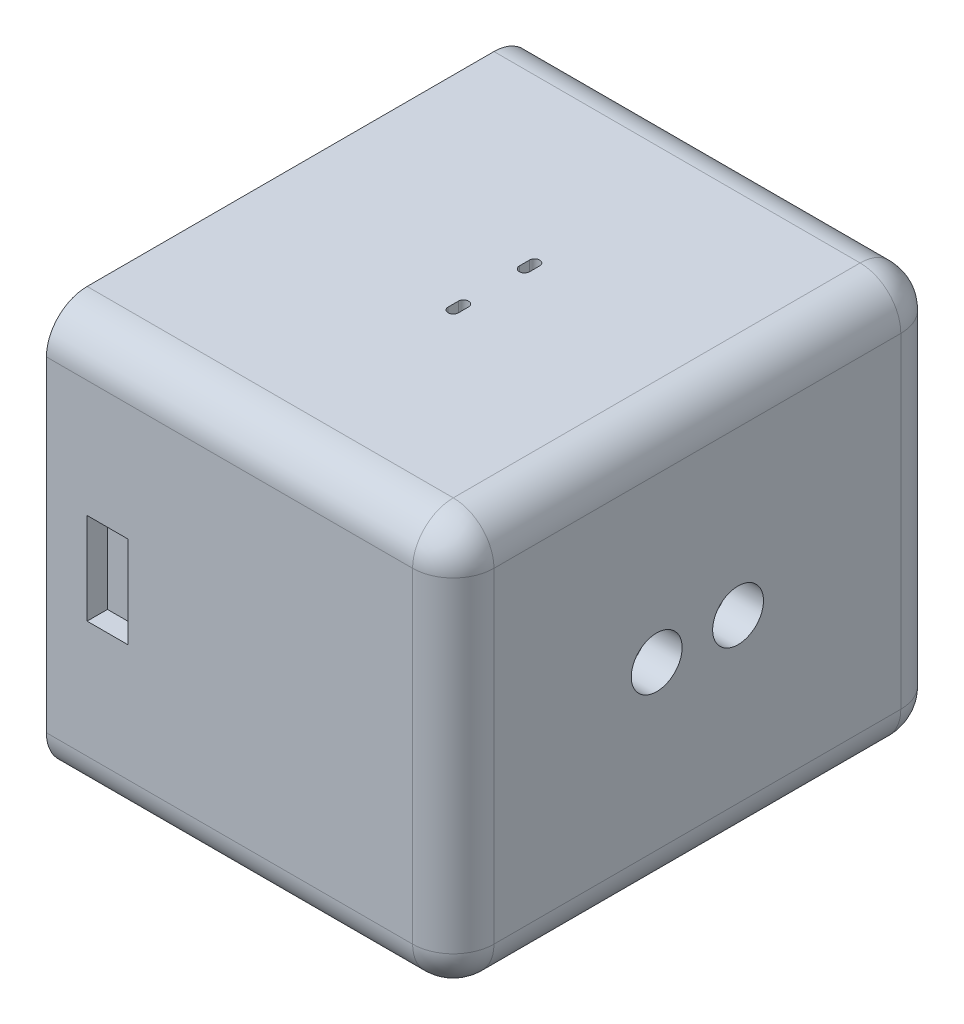
from build123d import *

# Parameters (mm, degrees)
SKETCH1_W           = 127
SKETCH1_H           = 152.4
BOSS_EXTRUDE1_DEPTH = 127
SHELL1_T            = -12.7
FILLET1_R           = 12.7
SKETCH3_W           = 23.988888889
SKETCH3_H           = 69.85
CUT_EXTRUDE1_DEPTH  = 9.525
SKETCH4_W           = 34.925
SKETCH4_H           = 79.375
CUT_EXTRUDE2_DEPTH  = 3.175
SKETCH5_W           = 12.7
SKETCH5_H           = 28.575
CUT_EXTRUDE3_DEPTH  = 6.35
CUT_EXTRUDE4_REACH  = 233.492
SKETCH6_W           = 6.35
SKETCH6_H           = 3.81
SKETCH7_R           = 7.9375
CUT_EXTRUDE5_DEPTH  = 11.1125
CUT_EXTRUDE6_REACH  = 231.749
SKETCH8_W           = 46.0375
SKETCH8_H           = 20.6375
CUT_EXTRUDE7_REACH  = 237.55
SKETCH9_R           = 2.38125
CUT_EXTRUDE8_REACH  = 237.55


with BuildPart() as part:
    # Sketch1 → Boss-Extrude1 (new body)
    with BuildSketch(Plane(origin=(0, 0, 0), x_dir=(1, 0, 0), z_dir=(0, 1, 0))):
        with Locations((63.5, 76.2)):
            Rectangle(SKETCH1_W, SKETCH1_H)
    extrude(amount=BOSS_EXTRUDE1_DEPTH)

    # Shell1
    shell1_openings = [part.faces().sort_by_distance(p)[0] for p in [
        (0, 63.5, -76.2),
    ]]
    offset(amount=SHELL1_T, openings=shell1_openings, kind=Kind.INTERSECTION)

    # Fillet1
    fillet1_edges = [part.edges().sort_by_distance(p)[0] for p in [
        (127, 127, -76.2),
        (63.5, 127, -152.4),
        (63.5, 0, -152.4),
        (127, 0, -76.2),
        (63.5, 0, 0),
        (63.5, 127, 0),
        (127, 63.5, -152.4),
        (127, 63.5, 0),
    ]]
    fillet(fillet1_edges, radius=FILLET1_R)

    # Sketch3 → Cut-Extrude1 (cut)
    with BuildSketch(Plane.XZ):
        with Locations((37.394444445, -76.2)):
            Rectangle(SKETCH3_W, SKETCH3_H)
    extrude(amount=-CUT_EXTRUDE1_DEPTH, mode=Mode.SUBTRACT)

    # Sketch4 → Cut-Extrude2 (cut)
    with BuildSketch(Plane(origin=(0, 12.7, 0), x_dir=(1, 0, 0), z_dir=(0, 1, 0))):
        with Locations((37.39388, 76.2)):
            Rectangle(SKETCH4_W, SKETCH4_H)
    extrude(amount=-CUT_EXTRUDE2_DEPTH, mode=Mode.SUBTRACT)

    # Sketch5 → Cut-Extrude3 (cut)
    with BuildSketch(Plane.XY):
        with Locations((19.05, 63.5)):
            Rectangle(SKETCH5_W, SKETCH5_H)
    extrude(amount=-CUT_EXTRUDE3_DEPTH, mode=Mode.SUBTRACT)

    # Sketch6 → Cut-Extrude4 (cut, up to next)
    with BuildSketch(Plane.XY.offset(-6.35), mode=Mode.PRIVATE) as cut_extrude4_sk1:
        with Locations((19.05, 75.8825)):
            Rectangle(SKETCH6_W, SKETCH6_H)
    cut_extrude4_tool1 = extrude(cut_extrude4_sk1.sketch, amount=-CUT_EXTRUDE4_REACH, mode=Mode.PRIVATE) & part.part
    add(cut_extrude4_tool1.solids().sort_by_distance((19.05, 75.8825, -6.35))[0], mode=Mode.SUBTRACT)

    # Sketch7 → Cut-Extrude5 (cut)
    with BuildSketch(Plane(origin=(127, 0, 0), x_dir=(0, 0, -1), z_dir=(1, 0, 0))):
        with Locations((63.5, 63.5)):
            Circle(SKETCH7_R)
        with Locations((88.9, 63.5)):
            Circle(SKETCH7_R)
    extrude(amount=-CUT_EXTRUDE5_DEPTH, mode=Mode.SUBTRACT)

    # Sketch8 → Cut-Extrude6 (cut, up to next)
    with BuildSketch(Plane(origin=(115.8875, 0, 0), x_dir=(0, 0, -1), z_dir=(1, 0, 0)), mode=Mode.PRIVATE) as cut_extrude6_sk1:
        with Locations((76.2, 63.5)):
            Rectangle(SKETCH8_W, SKETCH8_H)
    cut_extrude6_tool1 = extrude(cut_extrude6_sk1.sketch, amount=-CUT_EXTRUDE6_REACH, mode=Mode.PRIVATE) & part.part
    add(cut_extrude6_tool1.solids().sort_by_distance((115.8875, 63.5, -76.2))[0], mode=Mode.SUBTRACT)

    # Sketch9 → Cut-Extrude7 (cut, up to next)
    with BuildSketch(Plane(origin=(0, 0, -152.4), x_dir=(-1, 0, 0), z_dir=(0, 0, -1)), mode=Mode.PRIVATE) as cut_extrude7_sk1:
        with Locations((-38.1, 76.2)):
            Circle(SKETCH9_R)
    cut_extrude7_tool1 = extrude(cut_extrude7_sk1.sketch, amount=-CUT_EXTRUDE7_REACH, mode=Mode.PRIVATE) & part.part
    # Sketch9 → Cut-Extrude7 (cut, up to next)
    with BuildSketch(Plane(origin=(0, 0, -152.4), x_dir=(-1, 0, 0), z_dir=(0, 0, -1)), mode=Mode.PRIVATE) as cut_extrude7_sk2:
        with Locations((-38.1, 63.5)):
            Circle(SKETCH9_R)
    cut_extrude7_tool2 = extrude(cut_extrude7_sk2.sketch, amount=-CUT_EXTRUDE7_REACH, mode=Mode.PRIVATE) & part.part
    # Sketch9 → Cut-Extrude7 (cut, up to next)
    with BuildSketch(Plane(origin=(0, 0, -152.4), x_dir=(-1, 0, 0), z_dir=(0, 0, -1)), mode=Mode.PRIVATE) as cut_extrude7_sk3:
        with Locations((-38.1, 50.8)):
            Circle(SKETCH9_R)
    cut_extrude7_tool3 = extrude(cut_extrude7_sk3.sketch, amount=-CUT_EXTRUDE7_REACH, mode=Mode.PRIVATE) & part.part
    add(cut_extrude7_tool1.solids().sort_by_distance((38.1, 76.2, -152.4))[0], mode=Mode.SUBTRACT)
    add(cut_extrude7_tool2.solids().sort_by_distance((38.1, 63.5, -152.4))[0], mode=Mode.SUBTRACT)
    add(cut_extrude7_tool3.solids().sort_by_distance((38.1, 50.8, -152.4))[0], mode=Mode.SUBTRACT)

    # Sketch10 → Cut-Extrude8 (cut, up to next)
    with BuildSketch(Plane(origin=(0, 127, 0), x_dir=(1, 0, 0), z_dir=(0, 1, 0)), mode=Mode.PRIVATE) as cut_extrude8_sk1:
        with BuildLine():
            Line((61.9125, 88.9), (61.9125, 85.725))
            ThreePointArc((61.9125, 85.725), (63.5, 84.1375), (65.0875, 85.725))
            Line((65.0875, 85.725), (65.0875, 88.9))
            ThreePointArc((65.0875, 88.9), (63.5, 90.4875), (61.9125, 88.9))
        make_face()
    cut_extrude8_tool1 = extrude(cut_extrude8_sk1.sketch, amount=-CUT_EXTRUDE8_REACH, mode=Mode.PRIVATE) & part.part
    # Sketch10 → Cut-Extrude8 (cut, up to next)
    with BuildSketch(Plane(origin=(0, 127, 0), x_dir=(1, 0, 0), z_dir=(0, 1, 0)), mode=Mode.PRIVATE) as cut_extrude8_sk2:
        with BuildLine():
            Line((61.9125, 66.675), (61.9125, 63.5))
            ThreePointArc((61.9125, 63.5), (63.5, 61.9125), (65.0875, 63.5))
            Line((65.0875, 63.5), (65.0875, 66.675))
            ThreePointArc((65.0875, 66.675), (63.5, 68.2625), (61.9125, 66.675))
        make_face()
    cut_extrude8_tool2 = extrude(cut_extrude8_sk2.sketch, amount=-CUT_EXTRUDE8_REACH, mode=Mode.PRIVATE) & part.part
    add(cut_extrude8_tool1.solids().sort_by_distance((63.5, 127, -87.3125))[0], mode=Mode.SUBTRACT)
    add(cut_extrude8_tool2.solids().sort_by_distance((63.5, 127, -65.0875))[0], mode=Mode.SUBTRACT)


solid = part.part
